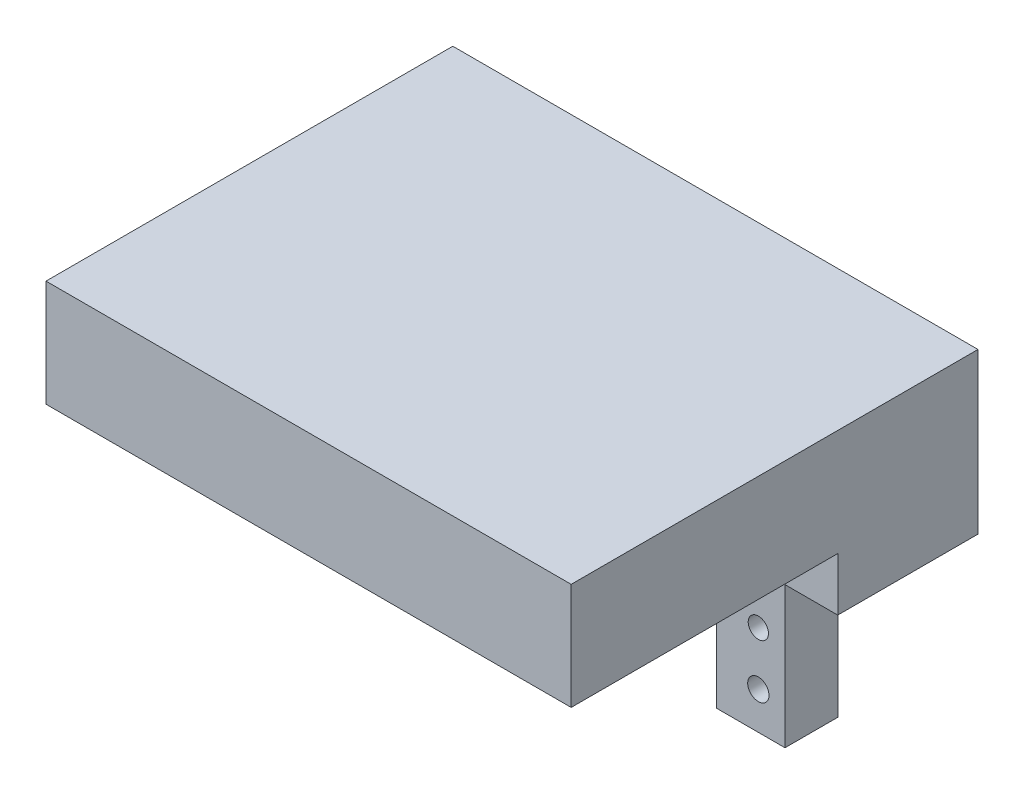
from build123d import *

# Parameters (mm, degrees)
SKETCH1_W                      = 25.019
SKETCH1_H                      = 6.6802
BOSS_EXTRUDE1_DEPTH            = 7.62
SKETCH2_W                      = 19.9898
SKETCH2_H                      = 1.651
CUT_EXTRUDE1_DEPTH             = 1.778
SKETCH5_W                      = 19.9898
SKETCH5_H                      = 2.5146
BOSS_EXTRUDE2_DEPTH            = 6.731
CUT_EXTRUDE2_REACH             = 18.974
SKETCH7_W                      = 8.1026
SKETCH7_H                      = 6.731
CUT_EXTRUDE2_DIRECTION_2_DEPTH = 17.973785465
CUT_EXTRUDE5_REACH             = 18.974
SKETCH8_R                      = 1.5748
SKETCH8_R_2                    = 0.4826
SKETCH8_R_3                    = 0.508
SKETCH9_W                      = 25.019
SKETCH9_H                      = 5.08
BOSS_EXTRUDE3_DEPTH            = 12.7


with BuildPart() as part:
    # Sketch1 → Boss-Extrude1 (new body)
    with BuildSketch(Plane(origin=(0, 0, 0), x_dir=(1, 0, 0), z_dir=(0, 1, 0))):
        with Locations((1.107398361, 2.278921311)):
            Rectangle(SKETCH1_W, SKETCH1_H)
    extrude(amount=BOSS_EXTRUDE1_DEPTH)

    # Sketch2 → Cut-Extrude1 (cut)
    with BuildSketch(Plane.XZ):
        with Locations((1.107398361, -2.278921311)):
            Rectangle(SKETCH2_W, SKETCH2_H)
    extrude(amount=-CUT_EXTRUDE1_DEPTH, mode=Mode.SUBTRACT)

    # Sketch5 → Boss-Extrude2 (add)
    with BuildSketch(Plane.XZ):
        with Locations((1.107398361, -0.196121311)):
            Rectangle(SKETCH5_W, SKETCH5_H)
    extrude(amount=BOSS_EXTRUDE2_DEPTH)

    # Sketch7 → Cut-Extrude2 (cut, up to next)
    with BuildSketch(Plane.XY.offset(1.061178689), mode=Mode.PRIVATE) as cut_extrude2_sk1:
        with Locations((3.799798361, -3.3655)):
            Rectangle(SKETCH7_W, SKETCH7_H)
    cut_extrude2_tool1 = extrude(cut_extrude2_sk1.sketch, amount=-CUT_EXTRUDE2_REACH, mode=Mode.PRIVATE) & part.part
    add(cut_extrude2_tool1.solids().sort_by_distance((3.799798, -3.3655, 1.061179))[0], mode=Mode.SUBTRACT)

    # Sketch7 → Cut-Extrude2 direction 2 (cut)
    with BuildSketch(Plane.XY.offset(1.061178689)):
        with Locations((3.799798361, -3.3655)):
            Rectangle(SKETCH7_W, SKETCH7_H)
    extrude(amount=CUT_EXTRUDE2_DIRECTION_2_DEPTH, mode=Mode.SUBTRACT)

    # Sketch8 → Cut-Extrude5 (cut, up to next)
    with BuildSketch(Plane.XY.offset(1.061178689), mode=Mode.PRIVATE) as cut_extrude5_sk1:
        with Locations((-6.347501639, -0.762)):
            Circle(SKETCH8_R)
    cut_extrude5_tool1 = extrude(cut_extrude5_sk1.sketch, amount=-CUT_EXTRUDE5_REACH, mode=Mode.PRIVATE) & part.part
    # Sketch8 → Cut-Extrude5 (cut, up to next)
    with BuildSketch(Plane.XY.offset(1.061178689), mode=Mode.PRIVATE) as cut_extrude5_sk2:
        with Locations((9.832298361, -2.413)):
            Circle(SKETCH8_R_2)
    cut_extrude5_tool2 = extrude(cut_extrude5_sk2.sketch, amount=-CUT_EXTRUDE5_REACH, mode=Mode.PRIVATE) & part.part
    # Sketch8 → Cut-Extrude5 (cut, up to next)
    with BuildSketch(Plane.XY.offset(1.061178689), mode=Mode.PRIVATE) as cut_extrude5_sk3:
        with Locations((9.832298361, -4.953)):
            Circle(SKETCH8_R_3)
    cut_extrude5_tool3 = extrude(cut_extrude5_sk3.sketch, amount=-CUT_EXTRUDE5_REACH, mode=Mode.PRIVATE) & part.part
    add(cut_extrude5_tool1.solids().sort_by_distance((-6.347502, -0.762, 1.061179))[0], mode=Mode.SUBTRACT)
    add(cut_extrude5_tool2.solids().sort_by_distance((9.832298, -2.413, 1.061179))[0], mode=Mode.SUBTRACT)
    add(cut_extrude5_tool3.solids().sort_by_distance((9.832298, -4.953, 1.061179))[0], mode=Mode.SUBTRACT)

    # Sketch9 → Boss-Extrude3 (add)
    with BuildSketch(Plane.XY.offset(1.061178689)):
        with Locations((1.107398361, 5.08)):
            Rectangle(SKETCH9_W, SKETCH9_H)
    extrude(amount=BOSS_EXTRUDE3_DEPTH)


solid = part.part
